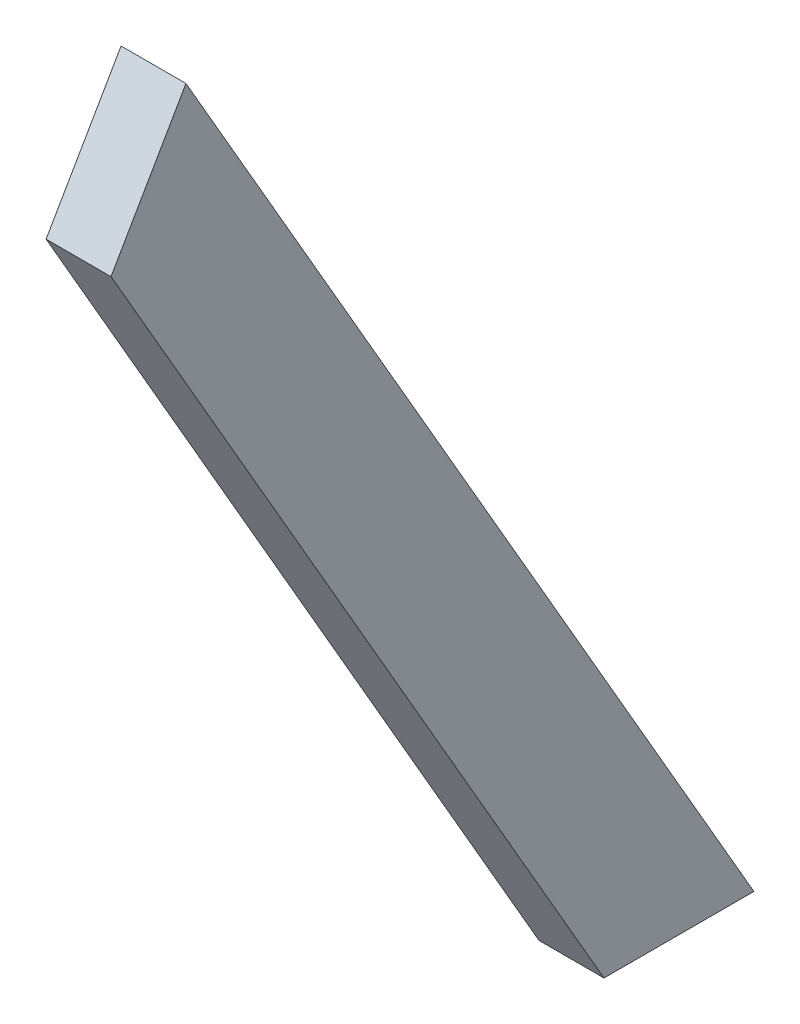
from build123d import *

# Parameters (mm, degrees)
BOSS_EXTRUDE1_DEPTH = 25.4


with BuildPart() as part:
    # Sketch2 → Boss-Extrude1 (new body)
    with BuildSketch(Plane(origin=(0, 0, 0), x_dir=(0, 0, -1), z_dir=(1, 0, 0))):
        Polygon((0, 0), (-192.920606325, 334.148291982), (-163.59121265, 384.948291982), (58.65878735, 0), align=None)
    extrude(amount=BOSS_EXTRUDE1_DEPTH)


solid = part.part
